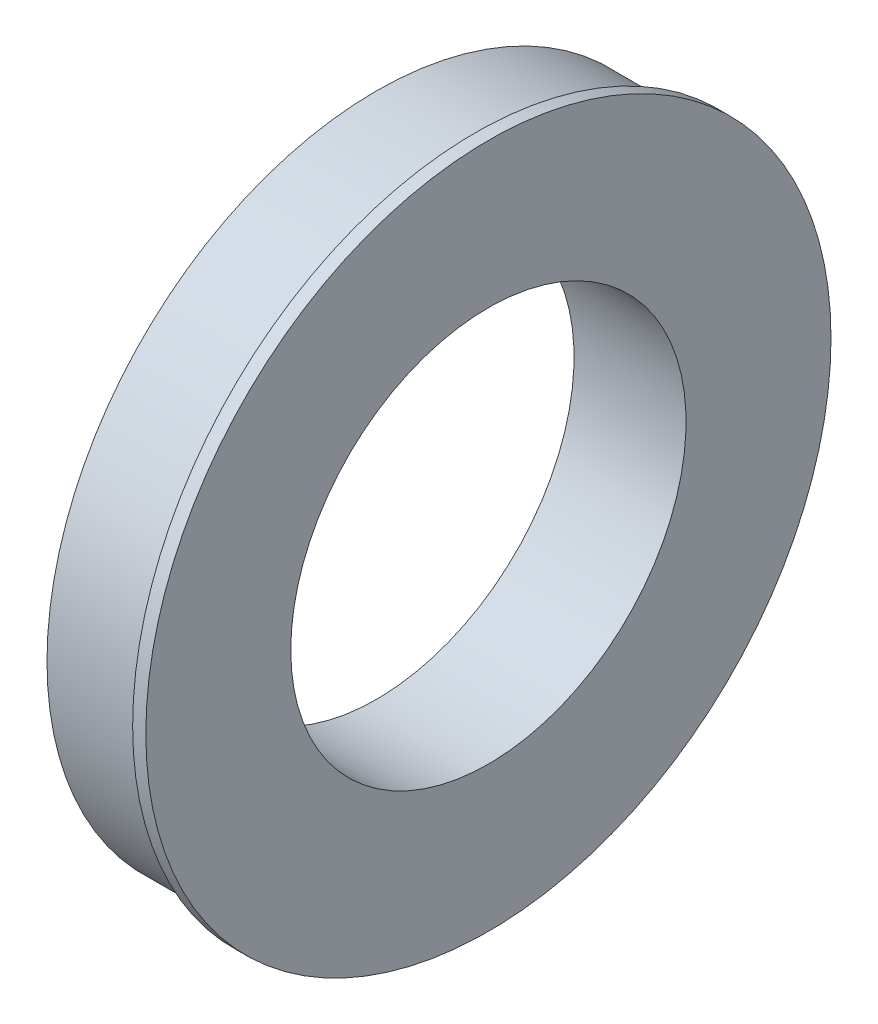
from build123d import *

# Parameters (mm, degrees)
SKETCH1_R           = 63.5
SKETCH1_R_2         = 38.1
BOSS_EXTRUDE3_DEPTH = 19.05
SKETCH5_R           = 66.04
SKETCH5_R_2         = 38.1
BOSS_EXTRUDE4_DEPTH = 2.54


with BuildPart() as part:
    # Sketch1 → Boss-Extrude3 (new body)
    with BuildSketch(Plane(origin=(0, 0, 0), x_dir=(0, 0, -1), z_dir=(1, 0, 0))):
        with Locations(Location((0, 0, 0), (0, 0, 180))):
            Circle(SKETCH1_R)
        with Locations(Location((0, 0, 0), (0, 0, 180))):
            Circle(SKETCH1_R_2, mode=Mode.SUBTRACT)
    extrude(amount=BOSS_EXTRUDE3_DEPTH)

    # Sketch5 → Boss-Extrude4 (add)
    with BuildSketch(Plane(origin=(19.05, 0, 0), x_dir=(0, 0, -1), z_dir=(1, 0, 0))):
        Circle(SKETCH5_R)
        with Locations(Location((0, 0, 0), (0, 0, 180))):
            Circle(SKETCH5_R_2, mode=Mode.SUBTRACT)
    extrude(amount=BOSS_EXTRUDE4_DEPTH)


solid = part.part
